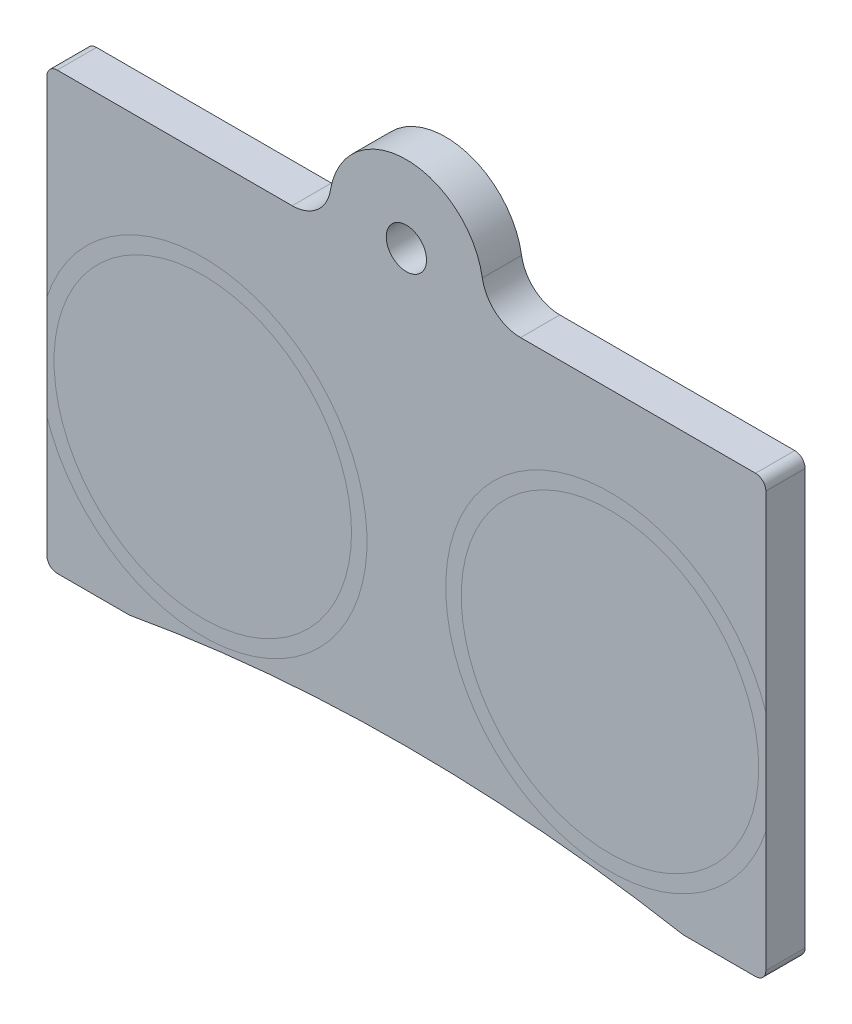
from build123d import *

# Parameters (mm, degrees)
SKETCH1_R      = 1.95
EXTRUDE1_DEPTH = 3.8


with BuildPart() as part:
    # Sketch1 → Extrude1 (new body)
    with BuildSketch(Plane.XY):
        with BuildLine():
            Line((26.8, -44.15), (33.8, -44.15))
            ThreePointArc((33.8, -44.15), (34.507106781, -43.857106781), (34.8, -43.15))
            Line((34.8, -43.15), (34.8, -2.95))
            ThreePointArc((34.8, -2.95), (34.507106781, -2.242893219), (33.8, -1.95))
            Line((33.8, -1.95), (11.054410884, -1.95))
            ThreePointArc((11.054410884, -1.95), (8.625166624, -1.056794064), (7.35315724, 1.197321429))
            ThreePointArc((7.35315724, 1.197321429), (0, 7.45), (-7.35315724, 1.197321429))
            ThreePointArc((-7.35315724, 1.197321429), (-8.625166624, -1.056794064), (-11.054410884, -1.95))
            Line((-11.054410884, -1.95), (-33.8, -1.95))
            ThreePointArc((-33.8, -1.95), (-34.507106781, -2.242893219), (-34.8, -2.95))
            Line((-34.8, -2.95), (-34.8, -43.15))
            ThreePointArc((-34.8, -43.15), (-34.507106781, -43.857106781), (-33.8, -44.15))
            Line((-33.8, -44.15), (-26.8, -44.15))
            ThreePointArc((-26.8, -44.15), (0, -41.75), (26.8, -44.15))
        make_face()
        with Locations(Location((0, 0, 0), (0, 0, 180))):
            Circle(SKETCH1_R, mode=Mode.SUBTRACT)
    extrude(amount=EXTRUDE1_DEPTH)


solid = part.part
